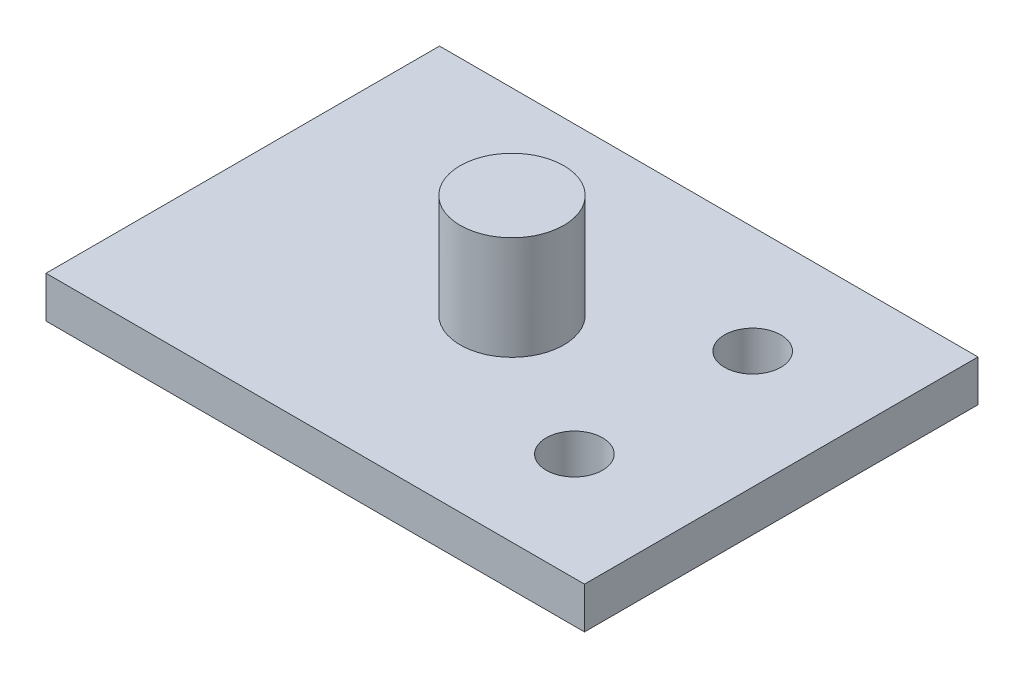
from build123d import *

# Parameters (mm, degrees)
SKETCH1_W             = 33.02
SKETCH1_H             = 24.13
BOSS_EXTRUDE1_DEPTH   = 2.54
SKETCH2_R             = 3.175
BOSS_EXTRUDE2_DEPTH   = 6.35
F_4_CLEARANCE_HOLE1_D = 3.4544


with BuildPart() as part:
    # Sketch1 → Boss-Extrude1 (new body)
    with BuildSketch(Plane(origin=(0, 0, 0), x_dir=(1, 0, 0), z_dir=(0, 1, 0))):
        Rectangle(SKETCH1_W, SKETCH1_H)
    extrude(amount=BOSS_EXTRUDE1_DEPTH)

    # Sketch2 → Boss-Extrude2 (add)
    with BuildSketch(Plane(origin=(0, 2.54, 0), x_dir=(1, 0, 0), z_dir=(0, 1, 0))):
        with Locations(Location((0, 0, 0), (0, 0, 90))):
            Circle(SKETCH2_R)
    extrude(amount=BOSS_EXTRUDE2_DEPTH)

    # #4 Clearance Hole1 (through all)
    with Locations(Plane(origin=(0, 2.54, 0), x_dir=(1, 0, 0), z_dir=(0, 1, 0))):
        with Locations((9.291486619, 5.466660474), (9.291486619, -5.466660474)):
            Hole(F_4_CLEARANCE_HOLE1_D / 2)


solid = part.part
